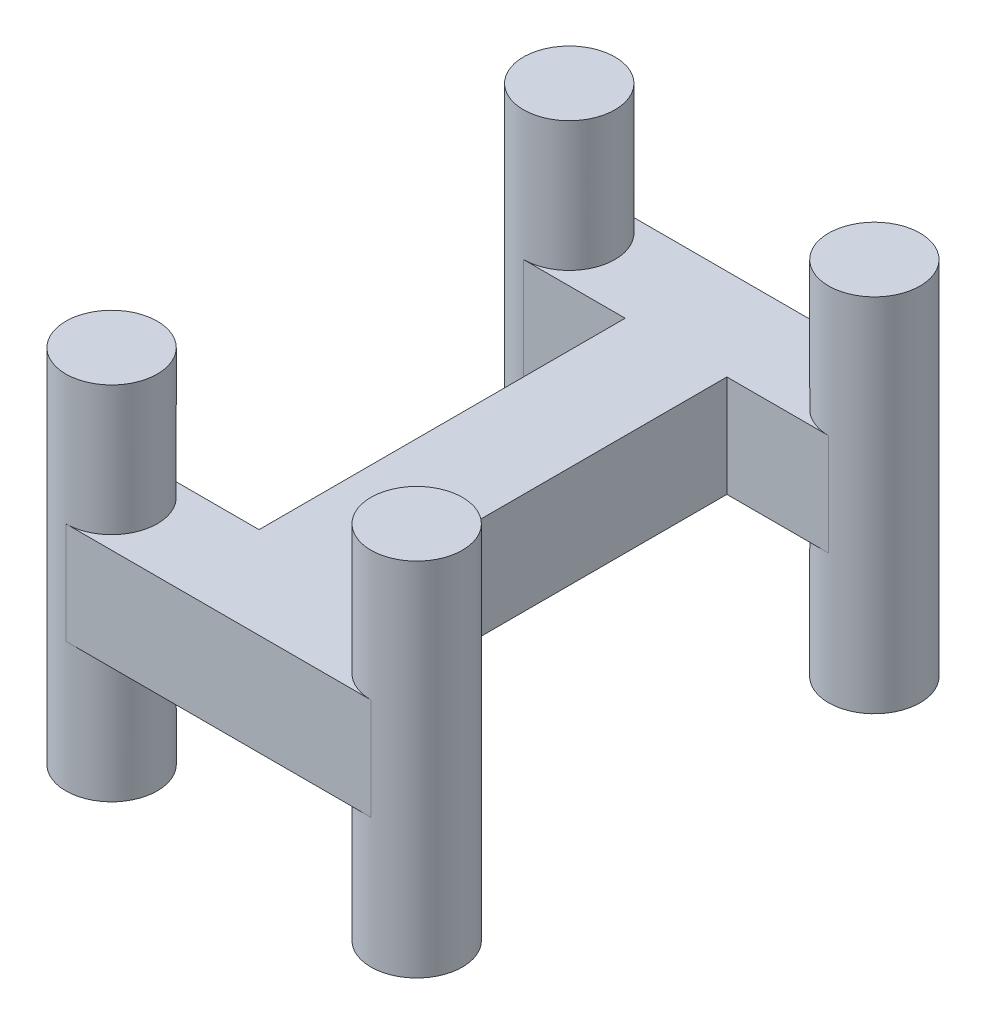
from build123d import *

# Parameters (mm, degrees)
BOSS_EXTRUDE1_DEPTH      = 2
BOSS_EXTRUDE1_DEPTH_BACK = 2
BOSS_EXTRUDE2_DEPTH      = 7.1
BOSS_EXTRUDE2_DEPTH_BACK = 7.1
SKETCH1_4_R              = 1.8


with BuildPart() as part:
    # Sketch1 → Boss-Extrude1 (new, two sides: drawn at the far end of the back side and taken through both)
    with BuildSketch(Plane(origin=(0, 0, 0), x_dir=(1, 0, 0), z_dir=(0, 1, 0)).offset(-BOSS_EXTRUDE1_DEPTH_BACK)):
        with BuildLine():
            ThreePointArc((-4.2, -9), (-4.727207794, -10.272792206), (-6, -10.8))
            Line((-6, -10.8), (6, -10.8))
            ThreePointArc((6, -10.8), (4.2, -9), (6, -7.2))
            Line((6, -7.2), (2, -7.2))
            Line((2, -7.2), (2, 7.2))
            Line((2, 7.2), (6, 7.2))
            ThreePointArc((6, 7.2), (4.2, 9), (6, 10.8))
            Line((6, 10.8), (-6, 10.8))
            ThreePointArc((-6, 10.8), (-4.727207794, 10.272792206), (-4.2, 9))
            ThreePointArc((-4.2, 9), (-4.727207794, 7.727207794), (-6, 7.2))
            Line((-6, 7.2), (-2, 7.2))
            Line((-2, 7.2), (-2, -7.2))
            Line((-2, -7.2), (-6, -7.2))
            ThreePointArc((-6, -7.2), (-4.727207794, -7.727207794), (-4.2, -9))
        make_face()
    extrude(amount=BOSS_EXTRUDE1_DEPTH + BOSS_EXTRUDE1_DEPTH_BACK)

    # Sketch1<4> → Boss-Extrude2 (add, two sides: drawn at the far end of the back side and taken through both)
    with BuildSketch(Plane(origin=(0, 0, 0), x_dir=(1, 0, 0), z_dir=(0, 1, 0)).offset(-BOSS_EXTRUDE2_DEPTH_BACK)):
        with Locations((-6, -9)):
            Circle(SKETCH1_4_R)
        with Locations((6, -9)):
            Circle(SKETCH1_4_R)
        with Locations((-6, 9)):
            Circle(SKETCH1_4_R)
        with Locations((6, 9)):
            Circle(SKETCH1_4_R)
    extrude(amount=BOSS_EXTRUDE2_DEPTH + BOSS_EXTRUDE2_DEPTH_BACK)


solid = part.part
